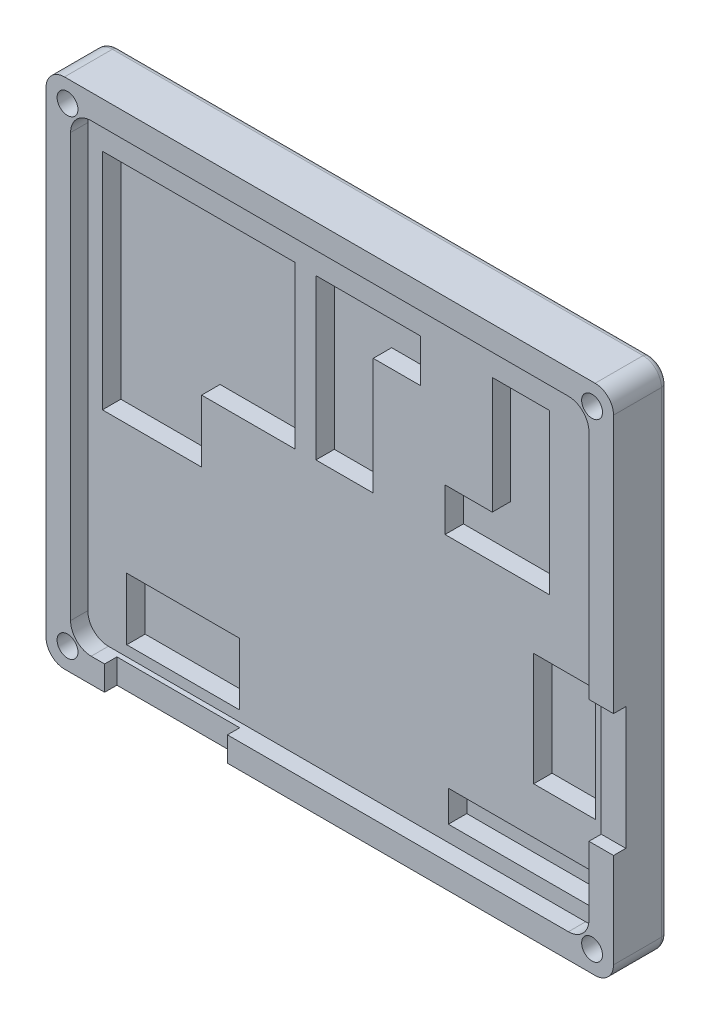
from build123d import *

# Parameters (mm, degrees)
BOSS_EXTRUDE1_DEPTH     = 4.4
BOSS_EXTRUDE2_DEPTH     = 1.5
SKETCH3_W               = 42.21
SKETCH3_H               = 37.765
SKETCH3_W_2             = 5.0500889
SKETCH3_H_2             = 9.1998476
SKETCH3_W_3             = 9.1998476
SKETCH3_H_3             = 5.0500889
SKETCH3_W_4             = 12.70002032
SKETCH3_H_4             = 2.54
BOSS_EXTRUDE3_DEPTH     = 1.5
BOSS_EXTRUDE4_START     = -4.4
BOSS_EXTRUDE4_DEPTH     = 4.4
SKETCH4_R               = 0.85
CUT_EXTRUDE1_DEPTH      = 32.45281913
MIRROR2_START           = -4.4
MIRROR2_COPY_1_DEPTH    = 4.4
MIRROR2_COPY_2_SKETCH_R = 0.85
MIRROR2_COPY_2_DEPTH    = 32.45281913
FILLET1_R               = 0.5
SKETCH7_W               = 10
SKETCH7_H               = 1
CUT_EXTRUDE2_DEPTH      = 3
SKETCH8_W               = 1
SKETCH8_H               = 10
CUT_EXTRUDE3_DEPTH      = 3


with BuildPart() as part:
    # Sketch1 → Boss-Extrude1 (new body)
    with BuildSketch(Plane.XY):
        with BuildLine():
            Line((-19.431, 20.8825), (19.431, 20.8825))
            ThreePointArc((19.431, 20.8825), (22.028910314, 19.806410314), (23.105, 17.2085))
            Line((23.105, 17.2085), (23.105, -17.2085))
            ThreePointArc((23.105, -17.2085), (22.028910314, -19.806410314), (19.431, -20.8825))
            Line((19.431, -20.8825), (-19.431, -20.8825))
            ThreePointArc((-19.431, -20.8825), (-22.028910314, -19.806410314), (-23.105, -17.2085))
            Line((-23.105, -17.2085), (-23.105, 17.2085))
            ThreePointArc((-23.105, 17.2085), (-22.028910314, 19.806410314), (-19.431, 20.8825))
        make_face()
        with BuildLine():
            Line((-19.431, -18.8825), (19.431, -18.8825))
            ThreePointArc((19.431, -18.8825), (20.614696752, -18.392196752), (21.105, -17.2085))
            Line((21.105, -17.2085), (21.105, 17.2085))
            ThreePointArc((21.105, 17.2085), (20.614696752, 18.392196752), (19.431, 18.8825))
            Line((19.431, 18.8825), (-19.431, 18.8825))
            ThreePointArc((-19.431, 18.8825), (-20.614696752, 18.392196752), (-21.105, 17.2085))
            Line((-21.105, 17.2085), (-21.105, -17.2085))
            ThreePointArc((-21.105, -17.2085), (-20.614696752, -18.392196752), (-19.431, -18.8825))
        make_face(mode=Mode.SUBTRACT)
    extrude(amount=BOSS_EXTRUDE1_DEPTH)

    # Sketch2 → Boss-Extrude2 (add)
    with BuildSketch(Plane(origin=(0, 0, 0), x_dir=(-1, 0, 0), z_dir=(0, 0, -1))):
        with BuildLine():
            Line((21.105, 17.2085), (21.105, -17.2085))
            ThreePointArc((21.105, -17.2085), (20.614696752, -18.392196752), (19.431, -18.8825))
            Line((19.431, -18.8825), (-19.431, -18.8825))
            ThreePointArc((-19.431, -18.8825), (-20.614696752, -18.392196752), (-21.105, -17.2085))
            Line((-21.105, -17.2085), (-21.105, 17.2085))
            ThreePointArc((-21.105, 17.2085), (-20.614696752, 18.392196752), (-19.431, 18.8825))
            Line((-19.431, 18.8825), (19.431, 18.8825))
            ThreePointArc((19.431, 18.8825), (20.614696752, 18.392196752), (21.105, 17.2085))
        make_face()
    extrude(amount=-BOSS_EXTRUDE2_DEPTH)

    # Sketch3 → Boss-Extrude3 (add)
    with BuildSketch(Plane.XY.offset(1.5)):
        Rectangle(SKETCH3_W, SKETCH3_H)
        Polygon((-19.91503683, 15.787528575), (-4.21501143, 15.787528575), (-4.21501143, 2.627508255), (-11.83502667, 2.627508255), (-11.83502667, -2.452501905), (-19.91503683, -2.452501905), align=None, mode=Mode.SUBTRACT)
        Polygon((5.98500889, 15.707528575), (5.98500889, 12.207528575), (2.138501397, 12.207528575), (2.138501397, 2.707508255), (-2.528503937, 2.707508255), (-2.528503937, 15.707528575), align=None, mode=Mode.SUBTRACT)
        Polygon((16.498531877, 2.707508255), (16.498531877, 15.707528575), (11.831526543, 15.707528575), (11.831526543, 6.207508255), (7.98501905, 6.207508255), (7.98501905, 2.707508255), align=None, mode=Mode.SUBTRACT)
        with Locations((17.726060452, -6.667513335)):
            Rectangle(SKETCH3_W_2, SKETCH3_H_2, mode=Mode.SUBTRACT)
        with Locations((-13.33502667, -15.503556007)):
            Rectangle(SKETCH3_W_3, SKETCH3_H_3, mode=Mode.SUBTRACT)
        with Locations((14.60502921, -16.319532639)):
            Rectangle(SKETCH3_W_4, SKETCH3_H_4, mode=Mode.SUBTRACT)
    extrude(amount=BOSS_EXTRUDE3_DEPTH)

    # Sketch5 → Boss-Extrude4 (add)
    with BuildSketch(Plane.XY.offset(4.4).offset(BOSS_EXTRUDE4_START)):
        with BuildLine():
            Line((19.431, 20.8825), (21.605, 20.8825))
            ThreePointArc((21.605, 20.8825), (22.665660172, 20.443160172), (23.105, 19.3825))
            Line((23.105, 19.3825), (23.105, 17.2085))
            ThreePointArc((23.105, 17.2085), (22.028910314, 19.806410314), (19.431, 20.8825))
        make_face()
    boss_extrude4 = extrude(amount=BOSS_EXTRUDE4_DEPTH)

    # Sketch4 → Cut-Extrude1 (cut, through all)
    with BuildSketch(Plane.XY.offset(4.4)):
        with Locations((21.357158872, 19.134658872)):
            Circle(SKETCH4_R)
    cut_extrude1 = extrude(amount=-CUT_EXTRUDE1_DEPTH, mode=Mode.SUBTRACT)

    # Mirror1: Boss-Extrude4, Cut-Extrude1 across plane
    add(boss_extrude4.mirror(Plane(origin=(0, 0, 0), x_dir=(0, 0, 1), z_dir=(1, 0, 0))))
    add(cut_extrude1.mirror(Plane(origin=(0, 0, 0), x_dir=(0, 0, 1), z_dir=(1, 0, 0))), mode=Mode.SUBTRACT)

    # Mirror2: Boss-Extrude4, Cut-Extrude1 across plane
    add(boss_extrude4.mirror(Plane.ZX))
    add(cut_extrude1.mirror(Plane.ZX), mode=Mode.SUBTRACT)

    # Mirror2 copy 1 sketch → Mirror2 copy 1 (add)
    with BuildSketch(Plane(origin=(0, 0, 4.4), x_dir=(-1, 0, 0), z_dir=(0, 0, 1)).offset(MIRROR2_START)):
        with BuildLine():
            Line((19.431, 20.8825), (21.605, 20.8825))
            ThreePointArc((21.605, 20.8825), (22.665660172, 20.443160172), (23.105, 19.3825))
            Line((23.105, 19.3825), (23.105, 17.2085))
            ThreePointArc((23.105, 17.2085), (22.028910314, 19.806410314), (19.431, 20.8825))
        make_face()
    extrude(amount=MIRROR2_COPY_1_DEPTH)

    # Mirror2 copy 2 sketch → Mirror2 copy 2 (cut, through all)
    with BuildSketch(Plane(origin=(0, 0, 4.4), x_dir=(-1, 0, 0), z_dir=(0, 0, 1))):
        with Locations((21.357158872, 19.134658872)):
            Circle(MIRROR2_COPY_2_SKETCH_R)
    extrude(amount=-MIRROR2_COPY_2_DEPTH, mode=Mode.SUBTRACT)

    # Fillet1
    fillet1_edges = [part.edges().sort_by_distance(p)[0] for p in [
        (-23.105, 0, 0),
        (22.665660172, 20.443160172, 0),
        (-22.665660172, 20.443160172, 0),
        (-22.665660172, -20.443160172, 0),
        (22.665660172, -20.443160172, 0),
        (0, 20.8825, 0),
        (23.105, 0, 0),
        (0, -20.8825, 0),
    ]]
    fillet(fillet1_edges, radius=FILLET1_R)

    # Sketch7 → Cut-Extrude2 (cut)
    with BuildSketch(Plane.XZ.offset(20.8825)):
        with Locations((-13.33502667, 3.9)):
            Rectangle(SKETCH7_W, SKETCH7_H)
    extrude(amount=-CUT_EXTRUDE2_DEPTH, mode=Mode.SUBTRACT)

    # Sketch8 → Cut-Extrude3 (cut)
    with BuildSketch(Plane(origin=(23.105, 0, 0), x_dir=(0, 0, -1), z_dir=(1, 0, 0))):
        with Locations((-3.9, -6.667513335)):
            Rectangle(SKETCH8_W, SKETCH8_H)
    extrude(amount=-CUT_EXTRUDE3_DEPTH, mode=Mode.SUBTRACT)


solid = part.part
